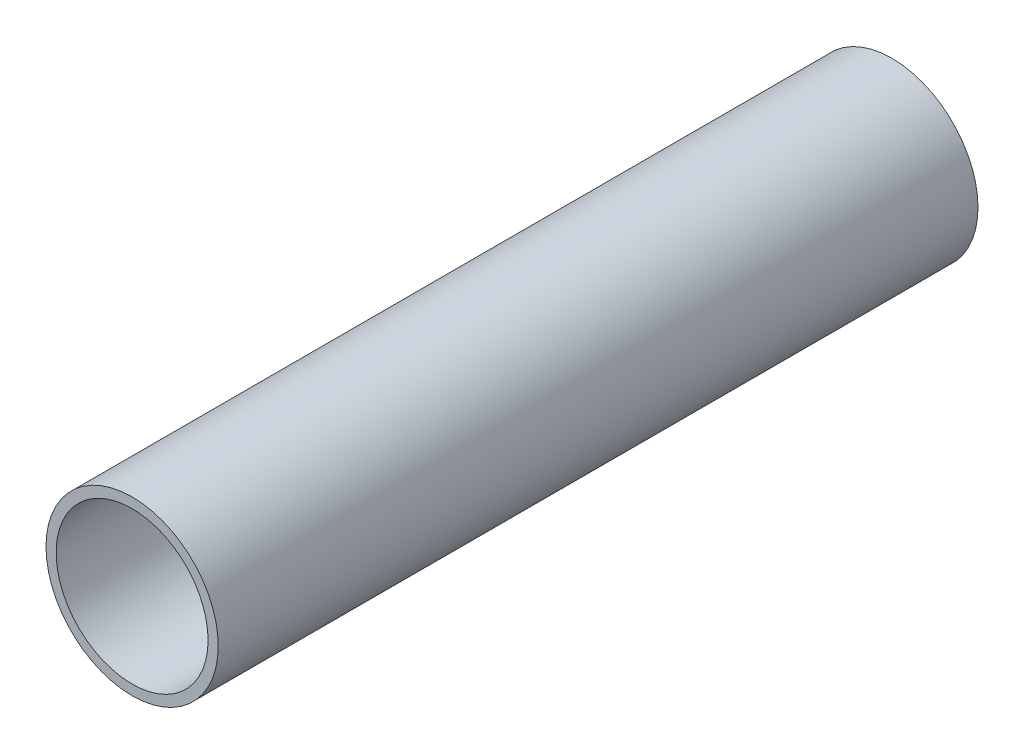
from build123d import *

# Parameters (mm, degrees)
SKETCH1_R           = 17
SKETCH1_R_2         = 15
BOSS_EXTRUDE1_DEPTH = 75


with BuildPart() as part:
    # Sketch1 → Boss-Extrude1 (new, symmetric)
    with BuildSketch(Plane.XY):
        Circle(SKETCH1_R)
        Circle(SKETCH1_R_2, mode=Mode.SUBTRACT)
    extrude(amount=BOSS_EXTRUDE1_DEPTH, both=True)


solid = part.part
